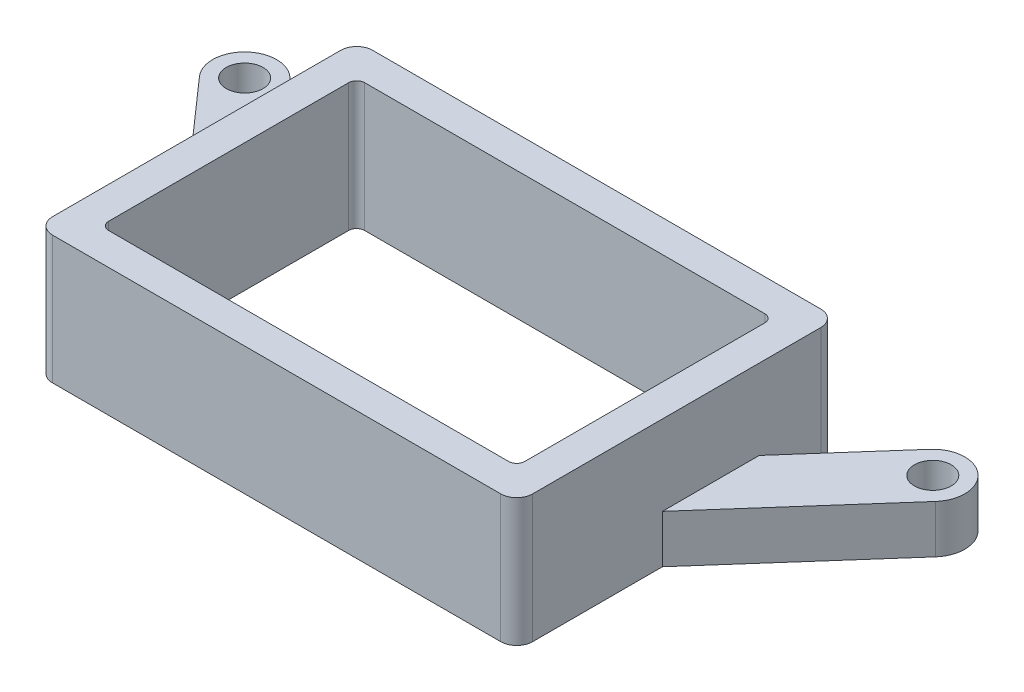
from build123d import *

# Parameters (mm, degrees)
SKETCH1_W           = 30
SKETCH1_H           = 20
SKETCH1_W_2         = 26
SKETCH1_H_2         = 16
SKETCH1_R           = 1.15
BOSS_EXTRUDE1_DEPTH = 3
SKETCH2_W           = 30
SKETCH2_H           = 20
SKETCH2_W_2         = 26
SKETCH2_H_2         = 16
BOSS_EXTRUDE2_DEPTH = 5
FILLET1_R           = 1
FILLET2_R           = 0.5


with BuildPart() as part:
    # Sketch1 → Boss-Extrude1 (new body)
    # profile 1 of 3: a face of its own
    with BuildSketch(Plane(origin=(0, 0, 0), x_dir=(1, 0, 0), z_dir=(0, 1, 0))):
        Rectangle(SKETCH1_W, SKETCH1_H)
        Rectangle(SKETCH1_W_2, SKETCH1_H_2, mode=Mode.SUBTRACT)
    # profile 2 of 3: a face of its own
    with BuildSketch(Plane(origin=(0, 0, 0), x_dir=(1, 0, 0), z_dir=(0, 1, 0))):
        with BuildLine():
            Line((-15, -0.894023008), (-15, 5.15340856))
            Line((-15, 5.15340856), (-20, 10.822875656))
            ThreePointArc((-20, 10.822875656), (-22.822875656, 11), (-23, 8.177124344))
            Line((-23, 8.177124344), (-15, -0.894023008))
        make_face()
        with Locations(Location((-21.5, 9.5, 0), (0, 0, 270))):
            Circle(SKETCH1_R, mode=Mode.SUBTRACT)
    # profile 3 of 3: a face of its own
    with BuildSketch(Plane(origin=(0, 0, 0), x_dir=(1, 0, 0), z_dir=(0, 1, 0))):
        with BuildLine():
            Line((20, 10.822875656), (15, 5.15340856))
            Line((15, 5.15340856), (15, -0.894023008))
            Line((15, -0.894023008), (23, 8.177124344))
            ThreePointArc((23, 8.177124344), (22.822875656, 11), (20, 10.822875656))
        make_face()
        with Locations(Location((21.5, 9.5, 0), (0, 0, 270))):
            Circle(SKETCH1_R, mode=Mode.SUBTRACT)
    extrude(amount=BOSS_EXTRUDE1_DEPTH)

    # Sketch2 → Boss-Extrude2 (add)
    with BuildSketch(Plane(origin=(0, 3, 0), x_dir=(1, 0, 0), z_dir=(0, 1, 0))):
        Rectangle(SKETCH2_W, SKETCH2_H)
        Rectangle(SKETCH2_W_2, SKETCH2_H_2, mode=Mode.SUBTRACT)
    extrude(amount=BOSS_EXTRUDE2_DEPTH)

    # Fillet1
    fillet1_edges = [part.edges().sort_by_distance(p)[0] for p in [
        (-15, 4, 10),
        (-15, 4, -10),
        (15, 4, -10),
        (15, 4, 10),
    ]]
    fillet(fillet1_edges, radius=FILLET1_R)

    # Fillet2
    fillet2_edges = [part.edges().sort_by_distance(p)[0] for p in [
        (13, 4, 8),
        (13, 4, -8),
        (-13, 4, -8),
        (-13, 4, 8),
    ]]
    fillet(fillet2_edges, radius=FILLET2_R)


solid = part.part
